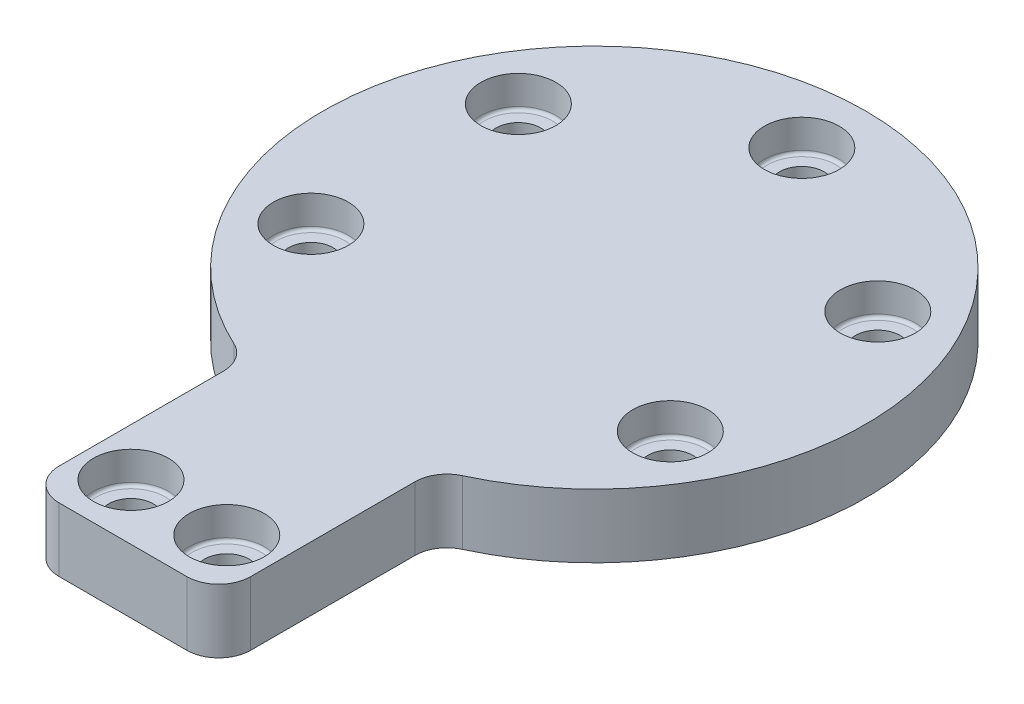
from build123d import *

# Parameters (mm, degrees)
SKETCH_1_R          = 1.4
EXTRUDE_1_DEPTH     = 4
SKETCH_2_R          = 2.35
CUT_EXTRUDE_1_DEPTH = 2
FILLET_1_R          = 0.2
FILLET_2_R          = 2


with BuildPart() as part:
    # 草图1 → 凸台-拉伸1 (new body)
    with BuildSketch(Plane(origin=(0, 0, 0), x_dir=(1, 0, 0), z_dir=(0, 1, 0))):
        with BuildLine():
            Line((-6, -22.03), (-6, -27.53))
            ThreePointArc((-6, -27.53), (-5.414213562, -28.944213562), (-4, -29.53))
            Line((-4, -29.53), (4, -29.53))
            ThreePointArc((4, -29.53), (5.414213562, -28.944213562), (6, -27.53))
            Line((6, -27.53), (6, -22.03))
            Line((6, -22.03), (6, -15.905973721))
            ThreePointArc((6, -15.905973721), (0, 17), (-6, -15.905973721))
            Line((-6, -15.905973721), (-6, -22.03))
        make_face()
        with Locations(Location((-3, -26.03, 0), (0, 0, 270))):
            Circle(SKETCH_1_R, mode=Mode.SUBTRACT)
        with Locations(Location((3, -26.03, 0), (0, 0, 270))):
            Circle(SKETCH_1_R, mode=Mode.SUBTRACT)
        with Locations(Location((0, 13, 0), (0, 0, 270))):
            Circle(SKETCH_1_R, mode=Mode.SUBTRACT)
        with Locations(Location((11.258330249, -6.5, 0), (0, 0, 270))):
            Circle(SKETCH_1_R, mode=Mode.SUBTRACT)
        with Locations(Location((-11.258330249, -6.5, 0), (0, 0, 270))):
            Circle(SKETCH_1_R, mode=Mode.SUBTRACT)
        with Locations(Location((-11.258330249, 6.5, 0), (0, 0, 270))):
            Circle(SKETCH_1_R, mode=Mode.SUBTRACT)
        with Locations(Location((11.258330249, 6.5, 0), (0, 0, 270))):
            Circle(SKETCH_1_R, mode=Mode.SUBTRACT)
    extrude(amount=EXTRUDE_1_DEPTH)

    # 草图2 → 切除-拉伸1 (cut)
    with BuildSketch(Plane(origin=(0, 4, 0), x_dir=(1, 0, 0), z_dir=(0, 1, 0))):
        with Locations(Location((0, 13, 0), (0, 0, 270))):
            Circle(SKETCH_2_R)
        with Locations(Location((11.258330249, 6.5, 0), (0, 0, 270))):
            Circle(SKETCH_2_R)
        with Locations(Location((11.258330249, -6.5, 0), (0, 0, 270))):
            Circle(SKETCH_2_R)
        with Locations(Location((-11.258330249, -6.5, 0), (0, 0, 270))):
            Circle(SKETCH_2_R)
        with Locations(Location((-11.258330249, 6.5, 0), (0, 0, 270))):
            Circle(SKETCH_2_R)
        with Locations(Location((-3, -26.03, 0), (0, 0, 270))):
            Circle(SKETCH_2_R)
        with Locations(Location((3, -26.03, 0), (0, 0, 270))):
            Circle(SKETCH_2_R)
    extrude(amount=-CUT_EXTRUDE_1_DEPTH, mode=Mode.SUBTRACT)

    # 圆角1
    fillet_1_edges = [part.edges().sort_by_distance(p)[0] for p in [
        (0, 2, -15.35),
        (11.258330249, 2, -8.85),
        (11.258330249, 2, 4.15),
        (-11.258330249, 2, 4.15),
        (-11.258330249, 2, -8.85),
        (-3, 2, 23.68),
        (3, 2, 23.68),
    ]]
    fillet(fillet_1_edges, radius=FILLET_1_R)

    # 圆角2
    fillet_2_edges = [part.edges().sort_by_distance(p)[0] for p in [
        (-6, 2, 15.905973721),
        (6, 2, 15.905973721),
    ]]
    fillet(fillet_2_edges, radius=FILLET_2_R)


solid = part.part
